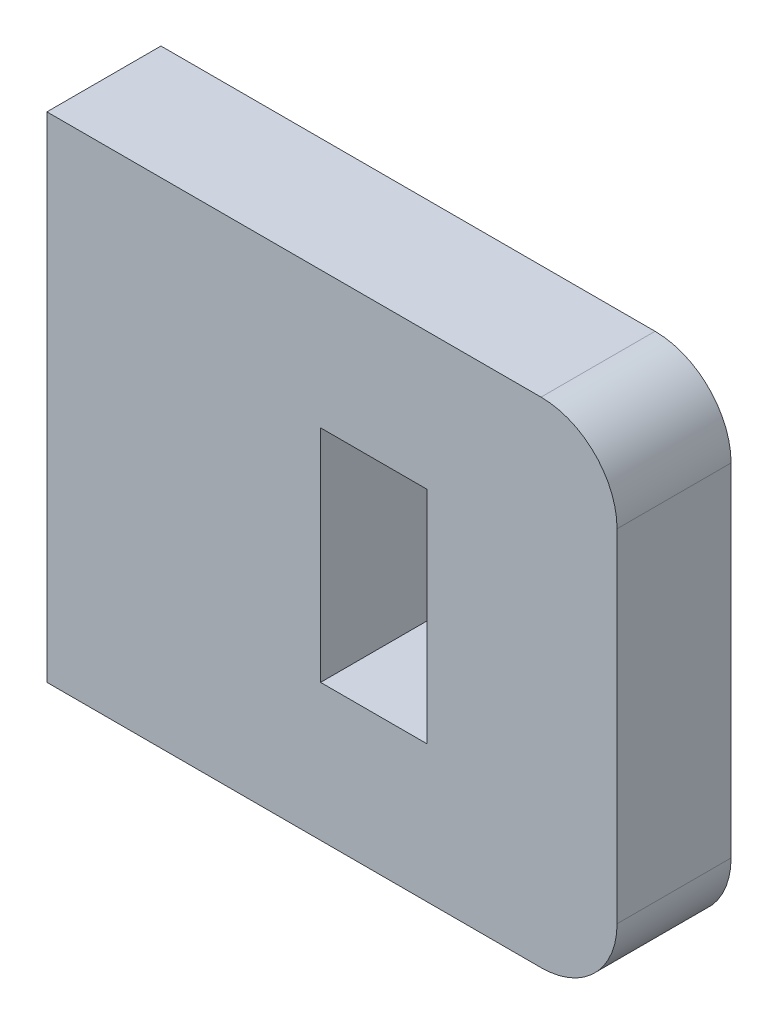
from build123d import *

# Parameters (mm, degrees)
CROQUIS1_W              = 2.8
CROQUIS1_H              = 5.8
SALIENTE_EXTRUIR1_DEPTH = 1.5
REDONDEO1_R             = 2


with BuildPart() as part:
    # Croquis1 → Saliente-Extruir1 (new, symmetric)
    # profile 1 of 3: a face of its own
    with BuildSketch(Plane.XY):
        Polygon((-4.5, -2.5), (-4.5, -6.5), (-1.5, -6.5), (10.5, -6.5), (10.5, 6.5), (-1.5, 6.5), (-4.5, 6.5), (-4.5, 0.5), align=None)
        with Locations((4.1, 0)):
            Rectangle(CROQUIS1_W, CROQUIS1_H, mode=Mode.SUBTRACT)
    # profile 2 of 3: a face of its own
    with BuildSketch(Plane.XY):
        Polygon((-4.5, -2.5), (-4.5, -6.5), (-1.5, -6.5), (10.5, -6.5), (10.5, 6.5), (-1.5, 6.5), (-4.5, 6.5), (-4.5, 0.5), align=None)
        with Locations((4.1, 0)):
            Rectangle(CROQUIS1_W, CROQUIS1_H, mode=Mode.SUBTRACT)
    # profile 3 of 3: a face of its own
    with BuildSketch(Plane.XY):
        Polygon((-4.5, -2.5), (-4.5, -6.5), (-1.5, -6.5), (10.5, -6.5), (10.5, 6.5), (-1.5, 6.5), (-4.5, 6.5), (-4.5, 0.5), align=None)
        with Locations((4.1, 0)):
            Rectangle(CROQUIS1_W, CROQUIS1_H, mode=Mode.SUBTRACT)
    extrude(amount=SALIENTE_EXTRUIR1_DEPTH, both=True)

    # Redondeo1
    redondeo1_edges = [part.edges().sort_by_distance(p)[0] for p in [
        (10.5, 6.5, 0),
        (10.5, -6.5, 0),
    ]]
    fillet(redondeo1_edges, radius=REDONDEO1_R)


solid = part.part
